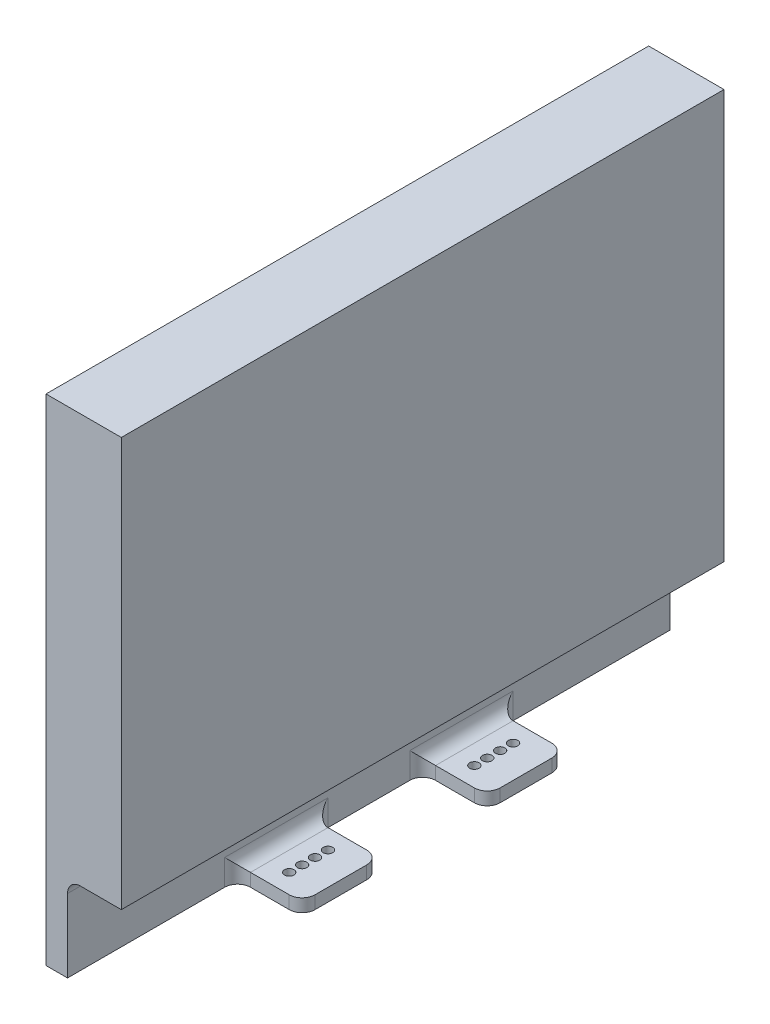
from build123d import *

# Parameters (mm, degrees)
SKETCH1_R            = 10
BOSS_EXTRUDE1_DEPTH  = 3
SKETCH2_R            = 5
BOSS_EXTRUDE2_DEPTH  = 100
CUT_EXTRUDE1_DEPTH   = 15
SKETCH4_W            = 14
SKETCH4_H            = 100
BOSS_EXTRUDE3_DEPTH  = 90
BOSS_EXTRUDE4_START  = 5
SKETCH5_R            = 10
BOSS_EXTRUDE4_DEPTH  = 3
SKETCH7_W            = 31.538450714
SKETCH7_H            = 13
CUT_EXTRUDE2_DEPTH   = 80
SKETCH8_W            = 9
SKETCH8_H            = 87
CUT_EXTRUDE3_DEPTH   = 130
SKETCH9_W            = 9
SKETCH9_H            = 25
CUT_EXTRUDE4_DEPTH   = 80
SKETCH10_W           = 37.5
SKETCH10_H           = 3
BOSS_EXTRUDE5_DEPTH  = 6
SKETCH11_R           = 1.1
CUT_EXTRUDE5_DEPTH   = 56
SKETCH14_W           = 15
SKETCH14_H           = 19.5
CUT_EXTRUDE6_DEPTH   = 56
FILLET1_R            = 3
SKETCH19_W           = 5
SKETCH19_H           = 100
BOSS_EXTRUDE6_DEPTH  = 25
SKETCH22_W           = 5
SKETCH22_H           = 115
BOSS_EXTRUDE8_DEPTH  = 20
SKETCH23_W           = 5
SKETCH23_H           = 115
BOSS_EXTRUDE9_DEPTH  = 20
SKETCH24_W           = 140
SKETCH24_H           = 95
BOSS_EXTRUDE10_DEPTH = 15
SKETCH25_W           = 130
SKETCH25_H           = 90
CUT_EXTRUDE7_DEPTH   = 10
FILLET2_R            = 3
SKETCH26_W           = 2.5
SKETCH26_H           = 95
CUT_EXTRUDE8_DEPTH   = 130
SKETCH27_W           = 2.5
SKETCH27_H           = 10
CUT_EXTRUDE9_DEPTH   = 136.255314129


with BuildPart() as part:
    # Sketch1 → Boss-Extrude1 (new body)
    with BuildSketch(Plane(origin=(0, 0, 0), x_dir=(1, 0, 0), z_dir=(0, 1, 0))):
        with Locations(Location((0, 0, 0), (0, 0, 270))):
            Circle(SKETCH1_R)
    extrude(amount=BOSS_EXTRUDE1_DEPTH)

    # Sketch2 → Boss-Extrude2 (add)
    with BuildSketch(Plane(origin=(0, 3, 0), x_dir=(1, 0, 0), z_dir=(0, 1, 0))):
        with Locations(Location((0, 0, 0), (0, 0, 270))):
            Circle(SKETCH2_R)
    extrude(amount=BOSS_EXTRUDE2_DEPTH)

    # Sketch3 → Cut-Extrude1 (cut)
    with BuildSketch(Plane.XZ):
        with BuildLine():
            ThreePointArc((-1.889982989, -1.636448686), (2.5, 0), (-1.889982989, 1.636448686))
            Line((-1.889982989, 1.636448686), (-1.889982989, -1.636448686))
        make_face()
    extrude(amount=-CUT_EXTRUDE1_DEPTH, mode=Mode.SUBTRACT)

    # Sketch4 → Boss-Extrude3 (add)
    with BuildSketch(Plane(origin=(0, 103, 0), x_dir=(1, 0, 0), z_dir=(0, 1, 0))):
        Rectangle(SKETCH4_W, SKETCH4_H)
    extrude(amount=-BOSS_EXTRUDE3_DEPTH)

    # Sketch5 → Boss-Extrude4 (add)
    with BuildSketch(Plane(origin=(0, 3, 0), x_dir=(1, 0, 0), z_dir=(0, 1, 0)).offset(BOSS_EXTRUDE4_START)):
        with Locations(Location((0, 0, 0), (0, 0, 270))):
            Circle(SKETCH5_R)
    extrude(amount=BOSS_EXTRUDE4_DEPTH)

    # Sketch7 → Cut-Extrude2 (cut)
    with BuildSketch(Plane.XY.offset(50)):
        with Locations((1.592851046, 6.5)):
            Rectangle(SKETCH7_W, SKETCH7_H)
    extrude(amount=-CUT_EXTRUDE2_DEPTH, mode=Mode.SUBTRACT)

    # Sketch8 → Cut-Extrude3 (cut)
    with BuildSketch(Plane.XY.offset(50)):
        with Locations((2.5, 59.5)):
            Rectangle(SKETCH8_W, SKETCH8_H)
    extrude(amount=-CUT_EXTRUDE3_DEPTH, mode=Mode.SUBTRACT)

    # Sketch9 → Cut-Extrude4 (cut)
    with BuildSketch(Plane(origin=(0, 16, 0), x_dir=(1, 0, 0), z_dir=(0, 1, 0))):
        with Locations((2.5, 0)):
            Rectangle(SKETCH9_W, SKETCH9_H)
    extrude(amount=-CUT_EXTRUDE4_DEPTH, mode=Mode.SUBTRACT)

    # Sketch10 → Boss-Extrude5 (add)
    with BuildSketch(Plane(origin=(7, 0, 0), x_dir=(0, 0, -1), z_dir=(1, 0, 0))):
        with Locations((-31.25, 14.5)):
            Rectangle(SKETCH10_W, SKETCH10_H)
        with Locations((31.25, 14.5)):
            Rectangle(SKETCH10_W, SKETCH10_H)
    extrude(amount=BOSS_EXTRUDE5_DEPTH)

    # Sketch11 → Cut-Extrude5 (cut)
    with BuildSketch(Plane(origin=(0, 16, 0), x_dir=(1, 0, 0), z_dir=(0, 1, 0))):
        with Locations(Location((5.5, -17, 0), (0, 0, 270))):
            Circle(SKETCH11_R)
        with Locations(Location((5.5, -20, 0), (0, 0, 270))):
            Circle(SKETCH11_R)
        with Locations(Location((5.5, -23, 0), (0, 0, 270))):
            Circle(SKETCH11_R)
        with Locations(Location((5.5, -26, 0), (0, 0, 270))):
            Circle(SKETCH11_R)
        with Locations(Location((5.5, 26, 0), (0, 0, 270))):
            Circle(SKETCH11_R)
        with Locations(Location((5.5, 23, 0), (0, 0, 270))):
            Circle(SKETCH11_R)
        with Locations(Location((5.5, 20, 0), (0, 0, 270))):
            Circle(SKETCH11_R)
        with Locations(Location((5.5, 17, 0), (0, 0, 270))):
            Circle(SKETCH11_R)
    extrude(amount=-CUT_EXTRUDE5_DEPTH, mode=Mode.SUBTRACT)

    # Sketch14 → Cut-Extrude6 (cut)
    with BuildSketch(Plane(origin=(0, 16, 0), x_dir=(1, 0, 0), z_dir=(0, 1, 0))):
        with Locations((5.5, -40.25)):
            Rectangle(SKETCH14_W, SKETCH14_H)
        with Locations((5.5, 40.25)):
            Rectangle(SKETCH14_W, SKETCH14_H)
    extrude(amount=-CUT_EXTRUDE6_DEPTH, mode=Mode.SUBTRACT)

    # Fillet1
    fillet1_edges = [part.edges().sort_by_distance(p)[0] for p in [
        (-2, 16, 21.5),
        (-2, 14.5, 12.5),
        (-2, 14.5, -12.5),
        (13, 14.5, 12.5),
        (13, 14.5, -12.5),
        (13, 14.5, -30.5),
        (13, 14.5, 30.5),
        (-2, 16, -21.5),
        (-2, 14.5, 30.5),
        (-2, 14.5, -30.5),
    ]]
    fillet(fillet1_edges, radius=FILLET1_R)

    # Sketch19 → Boss-Extrude6 (add)
    with BuildSketch(Plane(origin=(0, 103, 0), x_dir=(1, 0, 0), z_dir=(0, 1, 0))):
        with Locations((-4.5, 0)):
            Rectangle(SKETCH19_W, SKETCH19_H)
    extrude(amount=BOSS_EXTRUDE6_DEPTH)

    # Sketch22 → Boss-Extrude8 (add)
    with BuildSketch(Plane.XY.offset(50)):
        with Locations((-4.5, 70.5)):
            Rectangle(SKETCH22_W, SKETCH22_H)
    extrude(amount=BOSS_EXTRUDE8_DEPTH)

    # Sketch23 → Boss-Extrude9 (add)
    with BuildSketch(Plane(origin=(0, 0, -50), x_dir=(-1, 0, 0), z_dir=(0, 0, -1))):
        with Locations((4.5, 70.5)):
            Rectangle(SKETCH23_W, SKETCH23_H)
    extrude(amount=BOSS_EXTRUDE9_DEPTH)

    # Sketch24 → Boss-Extrude10 (add)
    with BuildSketch(Plane(origin=(-2, 0, 0), x_dir=(0, 0, -1), z_dir=(1, 0, 0))):
        with Locations((0, 80.5)):
            Rectangle(SKETCH24_W, SKETCH24_H)
    extrude(amount=BOSS_EXTRUDE10_DEPTH)

    # Sketch25 → Cut-Extrude7 (cut)
    with BuildSketch(Plane.ZY.offset(7)):
        with Locations((0, 80.5)):
            Rectangle(SKETCH25_W, SKETCH25_H)
    extrude(amount=-CUT_EXTRUDE7_DEPTH, mode=Mode.SUBTRACT)

    # Fillet2
    fillet2_edges = [part.edges().sort_by_distance(p)[0] for p in [
        (-2, 33, 0),
    ]]
    fillet(fillet2_edges, radius=FILLET2_R)

    # Sketch26 → Cut-Extrude8 (cut)
    with BuildSketch(Plane.XY.offset(70)):
        with Locations((11.75, 80.5)):
            Rectangle(SKETCH26_W, SKETCH26_H)
    extrude(amount=-CUT_EXTRUDE8_DEPTH, mode=Mode.SUBTRACT)

    # Sketch27 → Cut-Extrude9 (cut, through all)
    with BuildSketch(Plane(origin=(0, 128, 0), x_dir=(1, 0, 0), z_dir=(0, 1, 0))):
        with Locations((11.75, 65)):
            Rectangle(SKETCH27_W, SKETCH27_H)
    extrude(amount=-CUT_EXTRUDE9_DEPTH, mode=Mode.SUBTRACT)


solid = part.part
